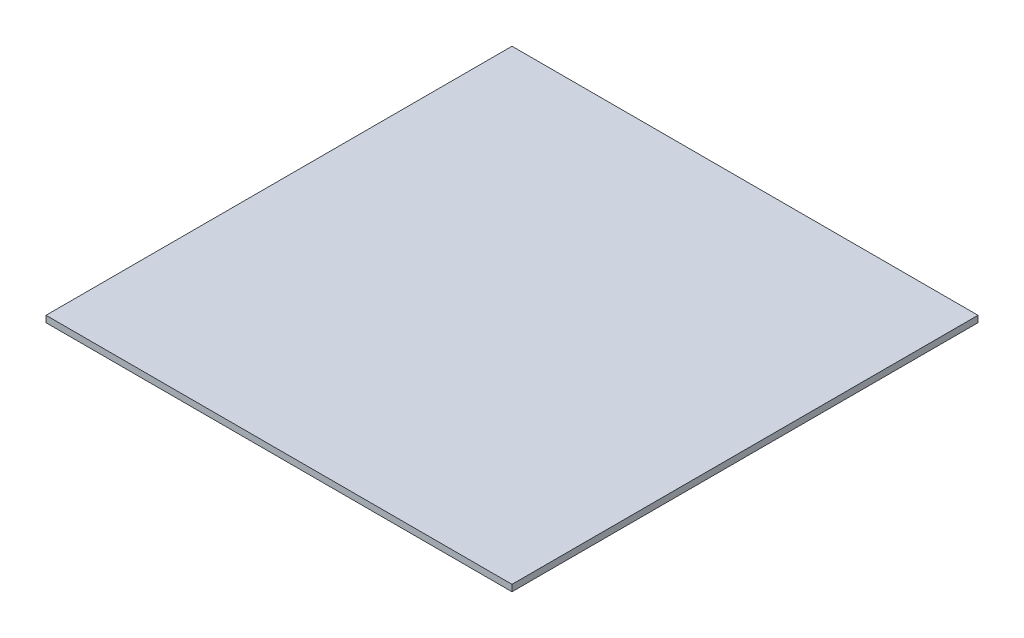
from build123d import *

# Parameters (mm, degrees)
SKETCH1_W      = 1828.8
SKETCH1_H      = 1828.8
EXTRUDE1_DEPTH = 25.4


with BuildPart() as part:
    # Sketch1 → Extrude1 (new body)
    with BuildSketch(Plane(origin=(0, 0, 0), x_dir=(1, 0, 0), z_dir=(0, 1, 0))):
        Rectangle(SKETCH1_W, SKETCH1_H)
    extrude(amount=-EXTRUDE1_DEPTH)


solid = part.part
